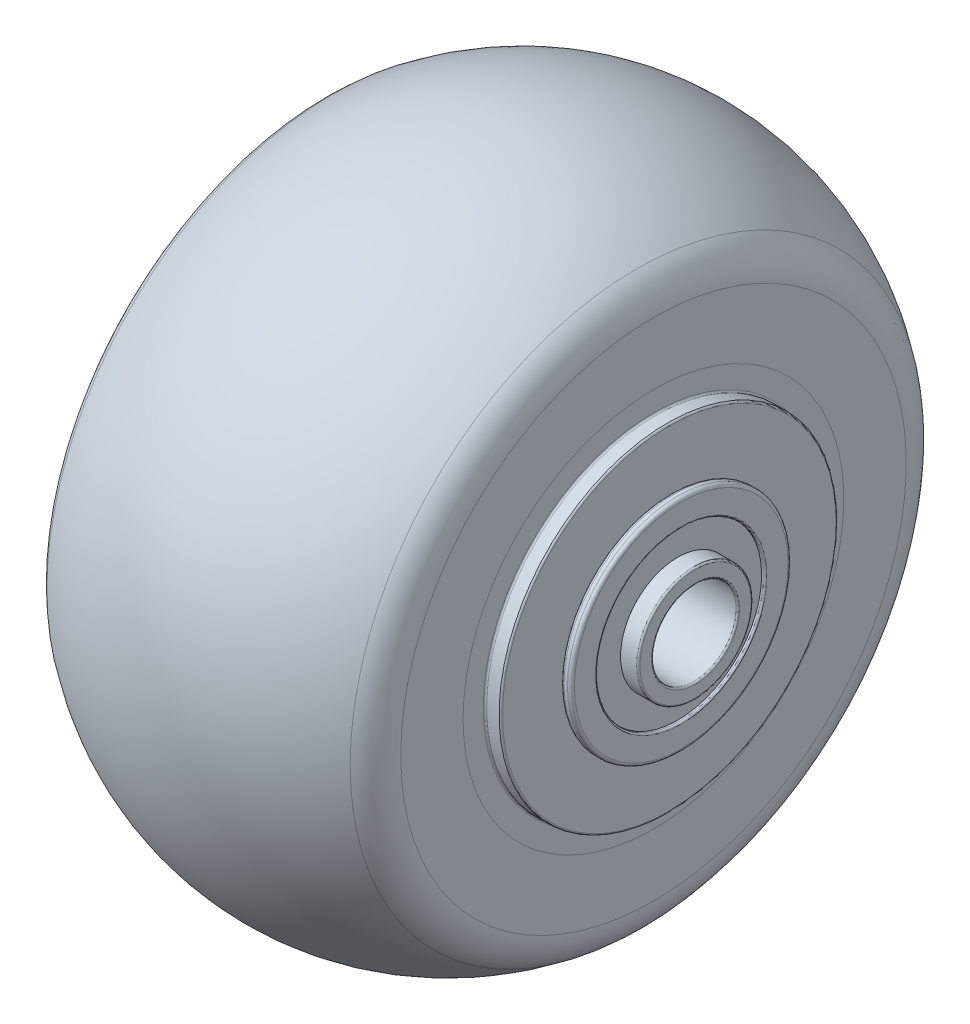
from build123d import *

# Parameters (mm, degrees)
SKETCH4_R           = 12.639278125
SKETCH4_R_2         = 8.64155625
BOSS_EXTRUDE1_DEPTH = 0.518583
FILLET1_R           = 0.254
FILLET3_R           = 0.254


with BuildPart() as part:
    # Sketch2 → Revolve1 (revolve)
    with BuildSketch(Plane.XY, mode=Mode.PRIVATE) as revolve1_sk:
        with BuildLine():
            Line((28.03525, -15.08125), (-28.03525, -15.08125))
            Line((-28.03525, -15.08125), (-28.03525, -16.118416667))
            ThreePointArc((-28.03525, -16.118416667), (-28.187139542, -16.485110458), (-28.553833333, -16.637))
            Line((-28.553833333, -16.637), (-29.072416667, -16.637))
            ThreePointArc((-29.072416667, -16.637), (-29.439110458, -16.485110458), (-29.591, -16.118416667))
            Line((-29.591, -16.118416667), (-29.591, -12.639278125))
            Line((-29.591, -12.639278125), (-28.553833333, -12.639278125))
            Line((-28.553833333, -12.639278125), (-28.553833333, -8.64155625))
            Line((-28.553833333, -8.64155625), (-31.75, -8.64155625))
            Line((-31.75, -8.64155625), (-31.75, -6.35))
            Line((-31.75, -6.35), (31.75, -6.35))
            Line((31.75, -6.35), (31.75, -8.64155625))
            Line((31.75, -8.64155625), (28.553833333, -8.64155625))
            Line((28.553833333, -8.64155625), (28.553833333, -12.639278125))
            Line((28.553833333, -12.639278125), (29.591, -12.639278125))
            Line((29.591, -12.639278125), (29.591, -16.118416667))
            ThreePointArc((29.591, -16.118416667), (29.439110458, -16.485110458), (29.072416667, -16.637))
            Line((29.072416667, -16.637), (28.553833333, -16.637))
            ThreePointArc((28.553833333, -16.637), (28.187139542, -16.485110458), (28.03525, -16.118416667))
            Line((28.03525, -16.118416667), (28.03525, -15.08125))
        make_face()
        with BuildLine():
            Line((25.4, -28.702), (-25.4, -28.702))
            Line((-25.4, -28.702), (-25.4, -38.1))
            ThreePointArc((-25.4, -38.1), (-24.729612663, -40.939806331), (-22.86, -43.18))
            ThreePointArc((-22.86, -43.18), (0, -50.8), (22.86, -43.18))
            ThreePointArc((22.86, -43.18), (24.729612663, -40.939806331), (25.4, -38.1))
            Line((25.4, -38.1), (25.4, -28.702))
        make_face()
    revolve(revolve1_sk.sketch.rotate(Axis((-27.78125, 0, 0), (1, 0, 0)), 270), axis=Axis((-27.78125, 0, 0), (1, 0, 0)))

    # Fillet1
    fillet1_edges = [part.edges().sort_by_distance(p)[0] for p in [
        (29.591, 0, -12.639278125),
        (31.75, 0, -8.64155625),
        (31.75, 0, -6.35),
        (-31.75, 0, -6.35),
        (-31.75, 0, -8.64155625),
        (-29.591, 0, -12.639278125),
    ]]
    fillet(fillet1_edges, radius=FILLET1_R)


with BuildPart() as body_2:
    # Sketch3 → Revolve2 (revolve)
    with BuildSketch(Plane.XY, mode=Mode.PRIVATE) as revolve2_sk:
        Polygon((27.78125, -15.08125), (-27.78125, -15.08125), (-27.78125, -25.40127), (-25.4, -25.40127), (-25.4, -28.702), (25.4, -28.702), (25.4, -25.40127), (27.78125, -25.40127), align=None)
    revolve(revolve2_sk.sketch.rotate(Axis((-27.78125, 0, 0), (1, 0, 0)), 270), axis=Axis((-27.78125, 0, 0), (1, 0, 0)))

    # Fillet3
    fillet3_edges = [body_2.edges().sort_by_distance(p)[0] for p in [
        (27.78125, 0, -25.40127),
        (-27.78125, 0, -25.40127),
        (-25.4, 0, -25.40127),
        (25.4, 0, -25.40127),
    ]]
    fillet(fillet3_edges, radius=FILLET3_R)


with BuildPart() as body_3:
    # Sketch4 → Boss-Extrude1 (new body)
    with BuildSketch(Plane(origin=(28.553833333, 0, 0), x_dir=(0, 0, -1), z_dir=(1, 0, 0))):
        Circle(SKETCH4_R)
        Circle(SKETCH4_R_2, mode=Mode.SUBTRACT)
    extrude(amount=BOSS_EXTRUDE1_DEPTH)


with BuildPart() as body_4:
    # Mirror2: mirrored copy
    add(body_3.part.mirror(Plane(origin=(0, 0, 0), x_dir=(0, 0, 1), z_dir=(1, 0, 0))))


solid = Compound([part.part, body_2.part, body_3.part, body_4.part])
